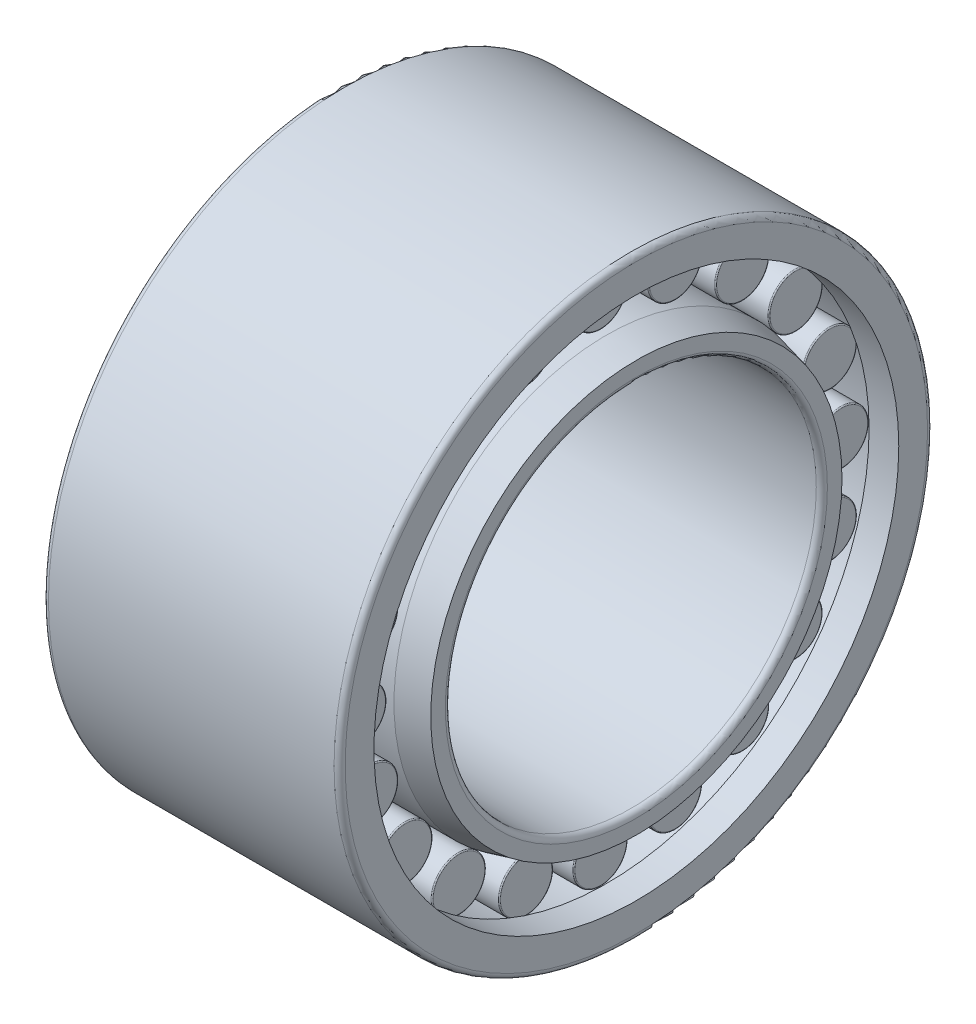
from build123d import *

# Parameters (mm, degrees)
ROLLERSDETAILED_COUNT = 20
ROLLERSDETAILED_ANGLE = 342


with BuildPart() as part:
    # OutRacSke → OuterRace (revolve)
    with BuildSketch(Plane.XY, mode=Mode.PRIVATE) as outerrace_sk:
        with BuildLine():
            Line((-6.4, 14.1475), (-8, 14.1475))
            Line((-8, 14.1475), (-8, 15.7))
            ThreePointArc((-8, 15.7), (-7.912132034, 15.912132034), (-7.7, 16))
            Line((-7.7, 16), (7.7, 16))
            ThreePointArc((7.7, 16), (7.912132034, 15.912132034), (8, 15.7))
            Line((8, 15.7), (8, 14.1475))
            Line((8, 14.1475), (6.4, 14.1475))
            Line((6.4, 14.1475), (6.4, 14.53))
            Line((6.4, 14.53), (-6.4, 14.53))
            Line((-6.4, 14.53), (-6.4, 14.1475))
        make_face()
    revolve(outerrace_sk.sketch.rotate(Axis((-90, 0, 0), (1, 0, 0)), 270), axis=Axis((-90, 0, 0), (1, 0, 0)))


with BuildPart() as body_2:
    # RolDetSke → RollerDetailed (revolve)
    with BuildSketch(Plane.XY, mode=Mode.PRIVATE) as rollerdetailed_sk:
        with BuildLine():
            Line((-6.08, 14.392), (-6.08, 13))
            Line((-6.08, 13), (6.08, 13))
            Line((6.08, 13), (6.08, 14.392))
            ThreePointArc((6.08, 14.392), (6.063012193, 14.433012193), (6.022, 14.45))
            Line((6.022, 14.45), (-6.022, 14.45))
            ThreePointArc((-6.022, 14.45), (-6.063012193, 14.433012193), (-6.08, 14.392))
        make_face()
    revolve(rollerdetailed_sk.sketch.rotate(Axis((-33.6, 13, 0), (1, 0, 0)), 270), axis=Axis((-33.6, 13, 0), (1, 0, 0)))


with BuildPart() as body_3:
    # InsRacSke → InnerRace (revolve)
    with BuildSketch(Plane.XY, mode=Mode.PRIVATE) as innerrace_sk:
        with BuildLine():
            Line((-6.4, 11.47), (-8, 11.0875))
            Line((-8, 11.0875), (-8, 10.3))
            ThreePointArc((-8, 10.3), (-7.912132034, 10.087867966), (-7.7, 10))
            Line((-7.7, 10), (7.7, 10))
            ThreePointArc((7.7, 10), (7.912132034, 10.087867966), (8, 10.3))
            Line((8, 10.3), (8, 11.0875))
            Line((8, 11.0875), (6.4, 11.47))
            Line((6.4, 11.47), (-6.4, 11.47))
        make_face()
    revolve(innerrace_sk.sketch.rotate(Axis((-90, 0, 0), (1, 0, 0)), 270), axis=Axis((-90, 0, 0), (1, 0, 0)))


with BuildPart() as rollersdetailed_1:
    # RollersDetailed: pattern copy
    add(body_2.part.rotate(Axis((-50, 0, 0), (1, 0, 0)), 1 * ROLLERSDETAILED_ANGLE / (ROLLERSDETAILED_COUNT - 1)))


with BuildPart() as rollersdetailed_2:
    # RollersDetailed: pattern copy
    add(body_2.part.rotate(Axis((-50, 0, 0), (1, 0, 0)), 2 * ROLLERSDETAILED_ANGLE / (ROLLERSDETAILED_COUNT - 1)))


with BuildPart() as rollersdetailed_3:
    # RollersDetailed: pattern copy
    add(body_2.part.rotate(Axis((-50, 0, 0), (1, 0, 0)), 3 * ROLLERSDETAILED_ANGLE / (ROLLERSDETAILED_COUNT - 1)))


with BuildPart() as rollersdetailed_4:
    # RollersDetailed: pattern copy
    add(body_2.part.rotate(Axis((-50, 0, 0), (1, 0, 0)), 4 * ROLLERSDETAILED_ANGLE / (ROLLERSDETAILED_COUNT - 1)))


with BuildPart() as rollersdetailed_5:
    # RollersDetailed: pattern copy
    add(body_2.part.rotate(Axis((-50, 0, 0), (1, 0, 0)), 5 * ROLLERSDETAILED_ANGLE / (ROLLERSDETAILED_COUNT - 1)))


with BuildPart() as rollersdetailed_6:
    # RollersDetailed: pattern copy
    add(body_2.part.rotate(Axis((-50, 0, 0), (1, 0, 0)), 6 * ROLLERSDETAILED_ANGLE / (ROLLERSDETAILED_COUNT - 1)))


with BuildPart() as rollersdetailed_7:
    # RollersDetailed: pattern copy
    add(body_2.part.rotate(Axis((-50, 0, 0), (1, 0, 0)), 7 * ROLLERSDETAILED_ANGLE / (ROLLERSDETAILED_COUNT - 1)))


with BuildPart() as rollersdetailed_8:
    # RollersDetailed: pattern copy
    add(body_2.part.rotate(Axis((-50, 0, 0), (1, 0, 0)), 8 * ROLLERSDETAILED_ANGLE / (ROLLERSDETAILED_COUNT - 1)))


with BuildPart() as rollersdetailed_9:
    # RollersDetailed: pattern copy
    add(body_2.part.rotate(Axis((-50, 0, 0), (1, 0, 0)), 9 * ROLLERSDETAILED_ANGLE / (ROLLERSDETAILED_COUNT - 1)))


with BuildPart() as rollersdetailed_10:
    # RollersDetailed: pattern copy
    add(body_2.part.rotate(Axis((-50, 0, 0), (1, 0, 0)), 10 * ROLLERSDETAILED_ANGLE / (ROLLERSDETAILED_COUNT - 1)))


with BuildPart() as rollersdetailed_11:
    # RollersDetailed: pattern copy
    add(body_2.part.rotate(Axis((-50, 0, 0), (1, 0, 0)), 11 * ROLLERSDETAILED_ANGLE / (ROLLERSDETAILED_COUNT - 1)))


with BuildPart() as rollersdetailed_12:
    # RollersDetailed: pattern copy
    add(body_2.part.rotate(Axis((-50, 0, 0), (1, 0, 0)), 12 * ROLLERSDETAILED_ANGLE / (ROLLERSDETAILED_COUNT - 1)))


with BuildPart() as rollersdetailed_13:
    # RollersDetailed: pattern copy
    add(body_2.part.rotate(Axis((-50, 0, 0), (1, 0, 0)), 13 * ROLLERSDETAILED_ANGLE / (ROLLERSDETAILED_COUNT - 1)))


with BuildPart() as rollersdetailed_14:
    # RollersDetailed: pattern copy
    add(body_2.part.rotate(Axis((-50, 0, 0), (1, 0, 0)), 14 * ROLLERSDETAILED_ANGLE / (ROLLERSDETAILED_COUNT - 1)))


with BuildPart() as rollersdetailed_15:
    # RollersDetailed: pattern copy
    add(body_2.part.rotate(Axis((-50, 0, 0), (1, 0, 0)), 15 * ROLLERSDETAILED_ANGLE / (ROLLERSDETAILED_COUNT - 1)))


with BuildPart() as rollersdetailed_16:
    # RollersDetailed: pattern copy
    add(body_2.part.rotate(Axis((-50, 0, 0), (1, 0, 0)), 16 * ROLLERSDETAILED_ANGLE / (ROLLERSDETAILED_COUNT - 1)))


with BuildPart() as rollersdetailed_17:
    # RollersDetailed: pattern copy
    add(body_2.part.rotate(Axis((-50, 0, 0), (1, 0, 0)), 17 * ROLLERSDETAILED_ANGLE / (ROLLERSDETAILED_COUNT - 1)))


with BuildPart() as rollersdetailed_18:
    # RollersDetailed: pattern copy
    add(body_2.part.rotate(Axis((-50, 0, 0), (1, 0, 0)), 18 * ROLLERSDETAILED_ANGLE / (ROLLERSDETAILED_COUNT - 1)))


with BuildPart() as rollersdetailed_19:
    # RollersDetailed: pattern copy
    add(body_2.part.rotate(Axis((-50, 0, 0), (1, 0, 0)), 19 * ROLLERSDETAILED_ANGLE / (ROLLERSDETAILED_COUNT - 1)))


solid = Compound([part.part, body_2.part, body_3.part, rollersdetailed_1.part, rollersdetailed_2.part, rollersdetailed_3.part, rollersdetailed_4.part, rollersdetailed_5.part, rollersdetailed_6.part, rollersdetailed_7.part, rollersdetailed_8.part, rollersdetailed_9.part, rollersdetailed_10.part, rollersdetailed_11.part, rollersdetailed_12.part, rollersdetailed_13.part, rollersdetailed_14.part, rollersdetailed_15.part, rollersdetailed_16.part, rollersdetailed_17.part, rollersdetailed_18.part, rollersdetailed_19.part])
